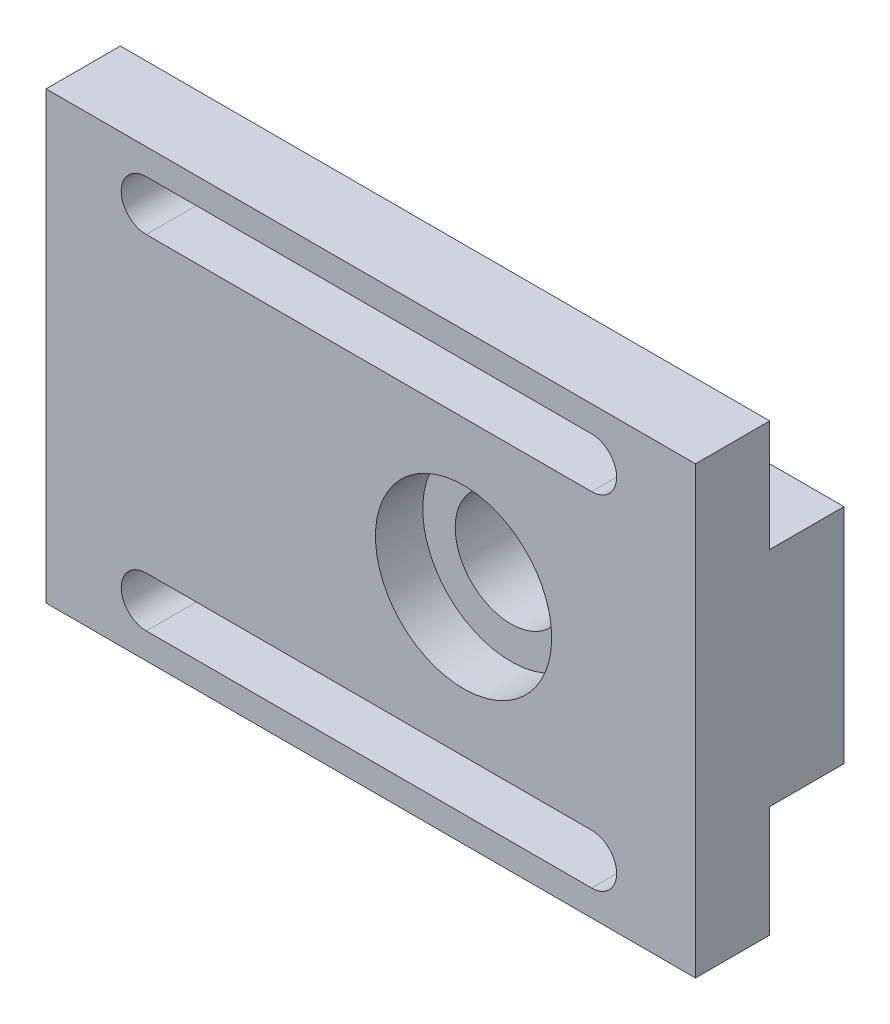
from build123d import *

# Parameters (mm, degrees)
SKETCH_1_W             = 70
SKETCH_1_H             = 48
EXTRUDE_1_DEPTH        = 8
SKETCH_2_W             = 70
SKETCH_2_H             = 24
EXTRUDE_2_DEPTH        = 8
SKETCH_3_R             = 6
CUT_EXTRUDE_1_DEPTH    = 87.371291527
SKETCH_6_R             = 9.5
CUT_EXTRUDE_4_DEPTH    = 5
CUT_EXTRUDE_START      = -5.1
SKETCH_7_R             = 9.5
CUT_EXTRUDE_5_DEPTH    = 5.1
HOLE_WIZARD_M4_1_D     = 3.3
HOLE_WIZARD_M4_1_DEPTH = 10.1
HOLE_WIZARD_M4_1_TIP   = 0.991420021
CUT_EXTRUDE_6_DEPTH    = 87.371291527


with BuildPart() as part:
    # 草图1 → 凸台-拉伸1 (new body)
    with BuildSketch(Plane.XY):
        with Locations((35, 24)):
            Rectangle(SKETCH_1_W, SKETCH_1_H)
    extrude(amount=EXTRUDE_1_DEPTH)

    # 草图2 → 凸台-拉伸2 (add)
    with BuildSketch(Plane(origin=(0, 0, 0), x_dir=(-1, 0, 0), z_dir=(0, 0, -1))):
        with Locations((-35, 24)):
            Rectangle(SKETCH_2_W, SKETCH_2_H)
    extrude(amount=EXTRUDE_2_DEPTH)

    # 草图3 → 切除-拉伸1 (cut, through all)
    with BuildSketch(Plane(origin=(0, 0, -8), x_dir=(-1, 0, 0), z_dir=(0, 0, -1))):
        with Locations((-45, 24)):
            Circle(SKETCH_3_R)
    extrude(amount=-CUT_EXTRUDE_1_DEPTH, mode=Mode.SUBTRACT)

    # 草图6 → 切除-拉伸4 (cut)
    with BuildSketch(Plane(origin=(0, 0, -8), x_dir=(-1, 0, 0), z_dir=(0, 0, -1))):
        with Locations((-45, 24)):
            Circle(SKETCH_6_R)
    extrude(amount=-CUT_EXTRUDE_4_DEPTH, mode=Mode.SUBTRACT)

    # 草图7 → 切除-拉伸5 (cut)
    with BuildSketch(Plane.XY.offset(8).offset(CUT_EXTRUDE_START)):
        with Locations(Location((45, 24, 0), (0, 0, 180))):
            Circle(SKETCH_7_R)
    extrude(amount=CUT_EXTRUDE_5_DEPTH, mode=Mode.SUBTRACT)

    # M4 螺纹孔1
    with Locations(Plane(origin=(0, 0, -8), x_dir=(-1, 0, 0), z_dir=(0, 0, -1))):
        with Locations((-57.5, 24), (-32.5, 24)):
            Hole(HOLE_WIZARD_M4_1_D / 2, depth=HOLE_WIZARD_M4_1_DEPTH)
            with Locations((0, 0, -(HOLE_WIZARD_M4_1_DEPTH + HOLE_WIZARD_M4_1_TIP / 2))):  # 118° drill point
                Cone(0, HOLE_WIZARD_M4_1_D / 2, HOLE_WIZARD_M4_1_TIP, mode=Mode.SUBTRACT)

    # 草图10 → 切除-拉伸6 (cut, through all)
    with BuildSketch(Plane.XY.offset(8)):
        with BuildLine():
            Line((10.800456012, 45.2), (58.800456012, 45.2))
            ThreePointArc((58.800456012, 45.2), (61.500456012, 42.5), (58.800456012, 39.8))
            Line((58.800456012, 39.8), (10.800456012, 39.8))
            ThreePointArc((10.800456012, 39.8), (8.100456012, 42.5), (10.800456012, 45.2))
        make_face()
        with BuildLine():
            Line((10.800456012, 2.8), (58.800456012, 2.8))
            ThreePointArc((58.800456012, 2.8), (61.500456012, 5.5), (58.800456012, 8.2))
            Line((58.800456012, 8.2), (10.800456012, 8.2))
            ThreePointArc((10.800456012, 8.2), (8.100456012, 5.5), (10.800456012, 2.8))
        make_face()
    extrude(amount=-CUT_EXTRUDE_6_DEPTH, mode=Mode.SUBTRACT)


solid = part.part
